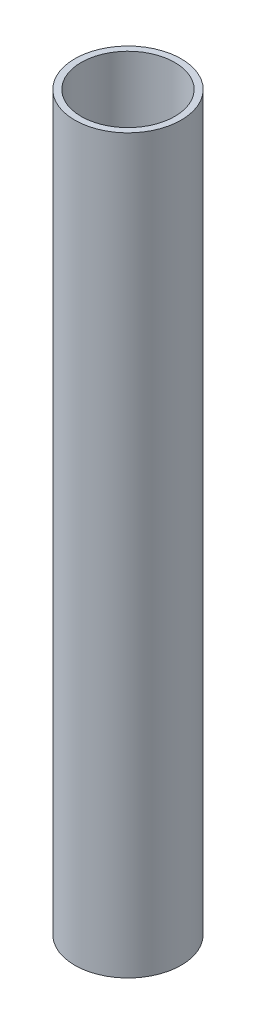
from build123d import *

# Parameters (mm, degrees)
SKETCH_1_R      = 12.5
SKETCH_1_R_2    = 11
EXTRUDE_1_DEPTH = 172


with BuildPart() as part:
    # 草图1 → 凸台-拉伸1 (new body)
    with BuildSketch(Plane(origin=(0, 0, 0), x_dir=(1, 0, 0), z_dir=(0, 1, 0))):
        with Locations(Location((0, 0, 0), (0, 0, 270))):
            Circle(SKETCH_1_R)
        with Locations(Location((0, 0, 0), (0, 0, 270))):
            Circle(SKETCH_1_R_2, mode=Mode.SUBTRACT)
    extrude(amount=EXTRUDE_1_DEPTH)


solid = part.part
